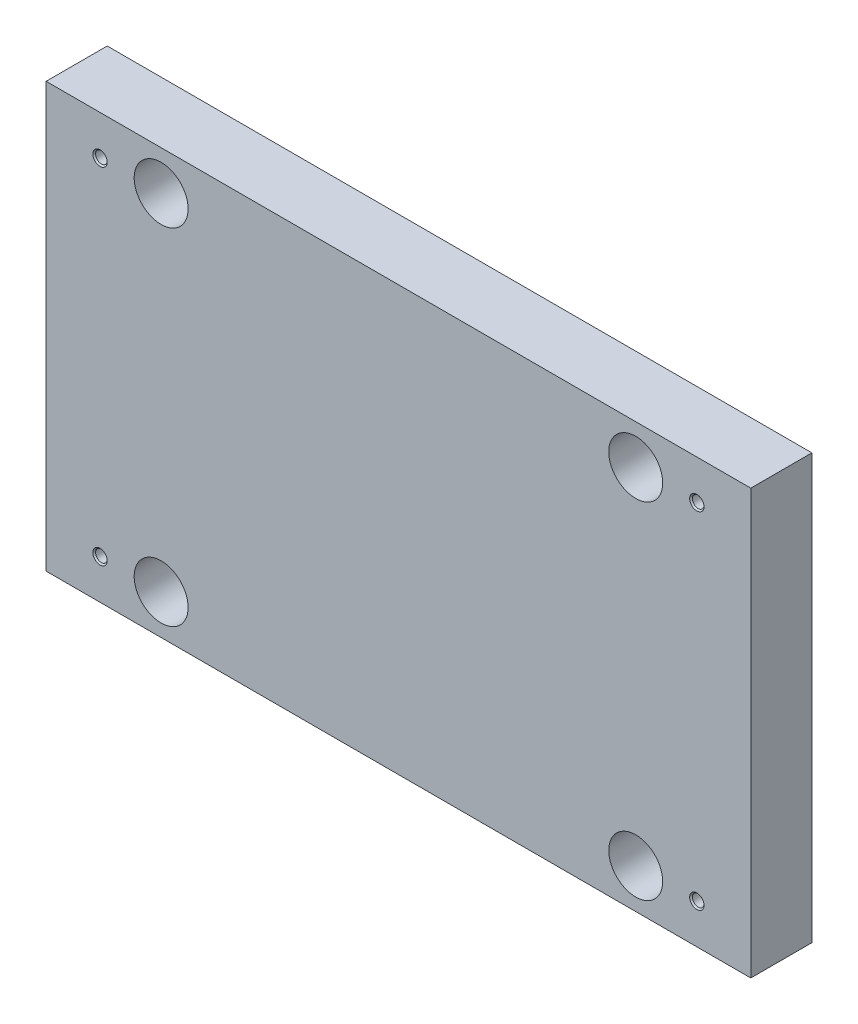
from build123d import *

# Parameters (mm, degrees)
SKETCH_1_W                  = 196
SKETCH_1_H                  = 118
EXTRUDE_1_DEPTH             = 17
HOLE_WIZARD_M31_D           = 3.242
HOLE_WIZARD_M31_DEPTH       = 11.218815752
HOLE_WIZARD_M31_TIP         = 0.935884786
HOLE_WIZARD_M81_D           = 9
HOLE_WIZARD_M81_CBORE_D     = 15
HOLE_WIZARD_M81_CBORE_DEPTH = 11
CHAMFER_1_SIZE              = 0.379


with BuildPart() as part:
    # Эскиз1 → Бобышка-Вытянуть1 (new body)
    with BuildSketch(Plane.XY.offset(17)):
        Rectangle(SKETCH_1_W, SKETCH_1_H)
    extrude(amount=-EXTRUDE_1_DEPTH)

    # Отверстие с зазором M31
    with Locations(Plane.XY.offset(17)):
        with Locations((-83, 48), (-83, -48), (83, 48), (83, -48)):
            Hole(HOLE_WIZARD_M31_D / 2, depth=HOLE_WIZARD_M31_DEPTH)
            with Locations((0, 0, -(HOLE_WIZARD_M31_DEPTH + HOLE_WIZARD_M31_TIP / 2))):  # 120° drill point
                Cone(0, HOLE_WIZARD_M31_D / 2, HOLE_WIZARD_M31_TIP, mode=Mode.SUBTRACT)

    # Цековка для  болта с шестигранной головкой M81 (through all)
    with Locations(Plane.XY.offset(17)):
        with Locations((66, 48), (66, -48), (-66, 48), (-66, -48)):
            CounterBoreHole(HOLE_WIZARD_M81_D / 2, HOLE_WIZARD_M81_CBORE_D / 2, HOLE_WIZARD_M81_CBORE_DEPTH)

    # Фаска1
    chamfer_1_edges = [part.edges().sort_by_distance(p)[0] for p in [
        (84.621, -48, 17),
        (84.621, 48, 17),
        (-81.379, -48, 17),
        (-81.379, 48, 17),
    ]]
    chamfer(chamfer_1_edges, length=CHAMFER_1_SIZE)


solid = part.part
